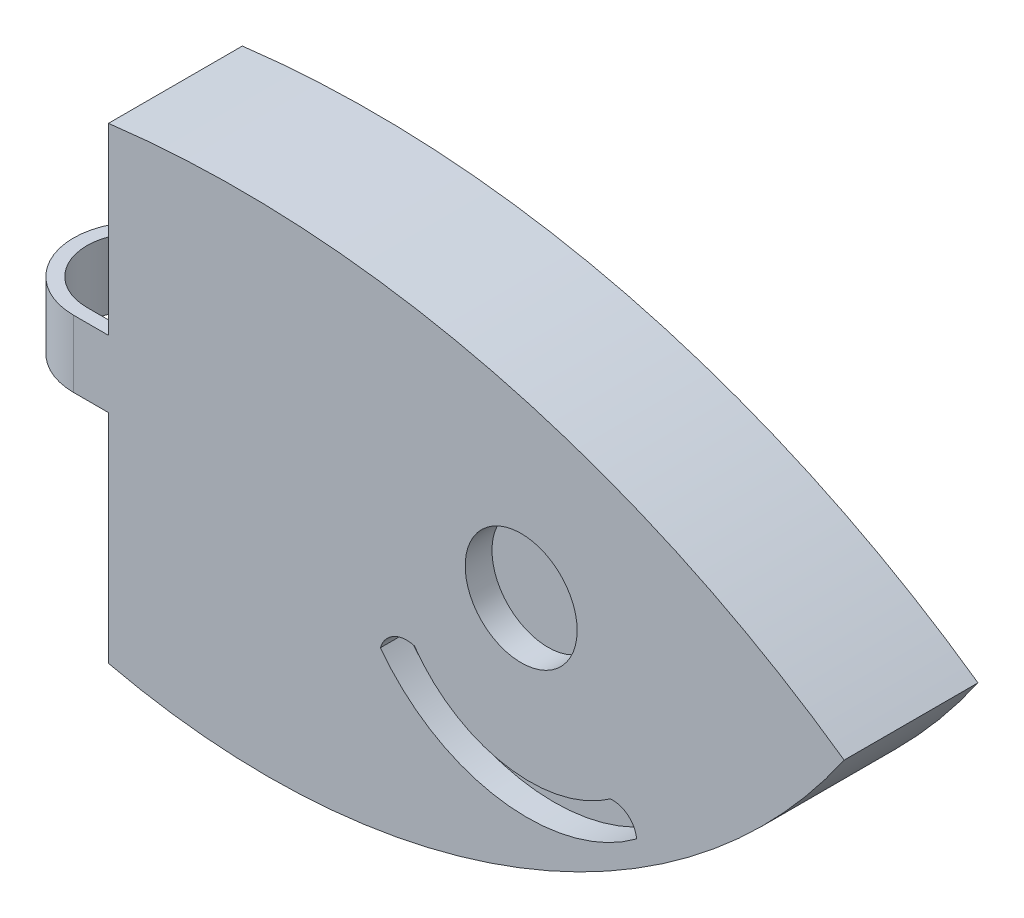
from build123d import *

# Parameters (mm, degrees)
EXTRUDE_1_DEPTH     = 10
SKETCH_2_R          = 4.182683646
CUT_EXTRUDE_1_DEPTH = 2
CUT_EXTRUDE_2_DEPTH = 2
EXTRUDE_2_DEPTH     = 5
CUT_EXTRUDE_4_DEPTH = 5


with BuildPart() as part:
    # 草圖1 → 填料-伸長1 (new body)
    with BuildSketch(Plane.XY):
        with BuildLine():
            Line((-54.969523774, 13.719179235), (-54.969523774, -21.22476033))
            ThreePointArc((-54.969523774, -21.22476033), (-24.214711694, -19.081408744), (0, 0))
            ThreePointArc((0, 0), (-26.203666434, 11.992637721), (-54.969523774, 13.719179235))
        make_face()
    extrude(amount=EXTRUDE_1_DEPTH)

    # 草圖2 → 除料-伸長1 (cut)
    with BuildSketch(Plane(origin=(-3.59892411, 0, 10), x_dir=(1, 0, 0), z_dir=(0, 0, 1))):
        with Locations((-20.534055943, -1.585781503)):
            Circle(SKETCH_2_R)
    extrude(amount=-CUT_EXTRUDE_1_DEPTH, mode=Mode.SUBTRACT)

    # 草圖3 → 除料-伸長2 (cut)
    with BuildSketch(Plane(origin=(-4.498655138, 1.869163063, 10), x_dir=(1, 0, 0), z_dir=(0, 0, 1))):
        with BuildLine():
            ThreePointArc((-30.154301824, -11.927771695), (-21.15958892, -17.29086396), (-11.007087523, -14.722920379))
            ThreePointArc((-11.007087523, -14.722920379), (-11.654774806, -13.513501992), (-12.967946819, -13.116298119))
            ThreePointArc((-12.967946819, -13.116298119), (-20.827814666, -14.857391145), (-27.616719206, -10.530763976))
            ThreePointArc((-27.616719206, -10.530763976), (-29.174840287, -10.703717268), (-30.154301824, -11.927771695))
        make_face()
    extrude(amount=-CUT_EXTRUDE_2_DEPTH, mode=Mode.SUBTRACT)

    # 草圖4 → 填料-伸長2 (add)
    with BuildSketch(Plane(origin=(0, 0, 0), x_dir=(1, 0, 0), z_dir=(0, 1, 0))):
        with BuildLine():
            Line((-54.969523774, 0), (-57.578183819, 0))
            ThreePointArc((-57.578183819, 0), (-62.578183819, -5), (-57.578183819, -10))
            Line((-57.578183819, -10), (-54.969523774, -10))
            Line((-54.969523774, -10), (-54.969523774, 0))
        make_face()
    extrude(amount=-EXTRUDE_2_DEPTH)

    # 草圖5 → 除料-伸長4 (cut)
    with BuildSketch(Plane(origin=(0, 0, 0), x_dir=(1, 0, 0), z_dir=(0, 1, 0))):
        with BuildLine():
            Line((-54.969523774, -1), (-57.578183819, -1))
            ThreePointArc((-57.578183819, -1), (-61.578183819, -5), (-57.578183819, -9))
            Line((-57.578183819, -9), (-54.969523774, -9))
            Line((-54.969523774, -9), (-54.969523774, -1))
        make_face()
    extrude(amount=-CUT_EXTRUDE_4_DEPTH, mode=Mode.SUBTRACT)


solid = part.part
